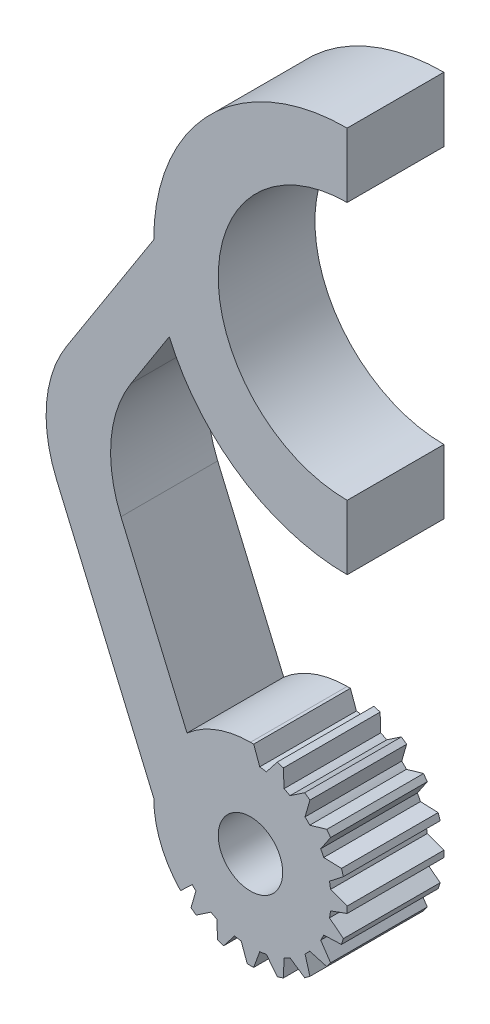
from build123d import *

# Parameters (mm, degrees)
BOSS_EXTRUDE1_DEPTH = 15
FILLET1_R           = 20
CUT_EXTRUDE1_START  = -15
CUT_EXTRUDE1_DEPTH  = 15
BOSS_EXTRUDE2_START = -15
BOSS_EXTRUDE2_DEPTH = 15


with BuildPart() as part:
    # Sketch1 → Boss-Extrude1 (new body)
    # profile 1 of 6: a face of its own
    with BuildSketch(Plane.XY):
        with BuildLine():
            Line((-20, -30), (-30, -30))
            ThreePointArc((-30, -30), (-29.388396861, -36.026784376), (-27.578524672, -41.807835403))
            Line((-27.578524672, -41.807835403), (-20, -30))
        make_face()
    # profile 2 of 6: a face of its own
    with BuildSketch(Plane.XY):
        with BuildLine():
            Line((0, -10), (0, 0))
            ThreePointArc((0, 0), (-21.213203436, -8.786796564), (-30, -30))
            Line((-30, -30), (-20, -30))
            ThreePointArc((-20, -30), (-14.142135624, -15.857864376), (0, -10))
        make_face()
    # profile 3 of 6: a face of its own
    with BuildSketch(Plane.XY):
        with BuildLine():
            Line((0, -60), (0, -50))
            ThreePointArc((0, -50), (-14.142135624, -44.142135624), (-20, -30))
            Line((-20, -30), (-27.578524672, -41.807835403))
            ThreePointArc((-27.578524672, -41.807835403), (-16.519154608, -55.04231481), (0, -60))
        make_face()
    # profile 4 of 6: a face of its own
    with BuildSketch(Plane.XY):
        with BuildLine():
            ThreePointArc((-27.578524672, -41.807835403), (-29.388396861, -36.026784376), (-30, -30))
            Line((-30, -30), (-49.254650189, -60))
            Line((-49.254650189, -60), (-30, -105))
            ThreePointArc((-30, -105), (-28.650020621, -98.780921528), (-24.84307506, -93.681260081))
            Line((-24.84307506, -93.681260081), (-39.254650189, -60))
            Line((-39.254650189, -60), (-27.578524672, -41.807835403))
        make_face()
    # profile 5 of 6: a face of its own
    with BuildSketch(Plane.XY):
        with BuildLine():
            ThreePointArc((-24.84307506, -93.681260081), (-28.650020621, -98.780921528), (-30, -105))
            Line((-30, -105), (-20, -105))
            Line((-20, -105), (-24.84307506, -93.681260081))
        make_face()
    # profile 6 of 6: a face of its own
    with BuildSketch(Plane.XY):
        with BuildLine():
            Line((-20, -105), (-30, -105))
            ThreePointArc((-30, -105), (-15, -120), (0, -105))
            ThreePointArc((0, -105), (-8.780921528, -91.349979379), (-24.84307506, -93.681260081))
            Line((-24.84307506, -93.681260081), (-20, -105))
        make_face()
        with BuildLine():
            ThreePointArc((-10, -105), (-15, -110), (-20, -105))
            ThreePointArc((-20, -105), (-15, -100), (-10, -105))
        make_face(mode=Mode.SUBTRACT)
    extrude(amount=BOSS_EXTRUDE1_DEPTH)

    # Fillet1
    fillet1_edges = [part.edges().sort_by_distance(p)[0] for p in [
        (-39.254650189, -60, 7.5),
        (-49.254650189, -60, 7.5),
    ]]
    fillet(fillet1_edges, radius=FILLET1_R)

    # Sketch2 → Cut-Extrude1 (cut)
    with BuildSketch(Plane.XY.offset(15).offset(CUT_EXTRUDE1_START)):
        with BuildLine():
            Line((-15, -90), (-15, -92.5))
            ThreePointArc((-15, -92.5), (-3.506810704, -109.914936399), (-24.038127106, -113.634944031))
            Line((-24.038127106, -113.634944031), (-25.845752528, -115.361932837))
            ThreePointArc((-25.845752528, -115.361932837), (-1.208172845, -110.897923679), (-15, -90))
        make_face()
    extrude(amount=CUT_EXTRUDE1_DEPTH, mode=Mode.SUBTRACT)

    # Sketch3 → Boss-Extrude2 (add)
    with BuildSketch(Plane.XY.offset(15).offset(BOSS_EXTRUDE2_START)):
        with BuildLine():
            Line((-14.5, -90), (-15, -90))
            Line((-15, -90), (-15, -92.5))
            ThreePointArc((-15, -92.5), (-14.279138, -92.520802992), (-13.560675373, -92.583142724))
            Line((-13.560675373, -92.583142724), (-14.5, -90))
        make_face()
        with BuildLine():
            Line((-10.840273343, -90.579643758), (-12.53185915, -92.746091205))
            ThreePointArc((-12.53185915, -92.746091205), (-11.13728757, -93.111793546), (-9.79410102, -93.635642746))
            Line((-9.79410102, -93.635642746), (-9.889216826, -90.888660753))
            Line((-9.889216826, -90.888660753), (-10.840273343, -90.579643758))
        make_face()
        with BuildLine():
            Line((-6.587729713, -92.570852458), (-8.865992497, -94.108537658))
            ThreePointArc((-8.865992497, -94.108537658), (-7.652684346, -94.88728757), (-6.53711633, -95.800565236))
            Line((-6.53711633, -95.800565236), (-5.778712718, -93.158637711))
            Line((-5.778712718, -93.158637711), (-6.587729713, -92.570852458))
        make_face()
        with BuildLine():
            Line((-3.158637711, -95.778712718), (-5.800565236, -96.53711633))
            ThreePointArc((-5.800565236, -96.53711633), (-4.88728757, -97.652684346), (-4.108537658, -98.865992497))
            Line((-4.108537658, -98.865992497), (-2.570852458, -96.587729713))
            Line((-2.570852458, -96.587729713), (-3.158637711, -95.778712718))
        make_face()
        with BuildLine():
            Line((-0.888660753, -99.889216826), (-3.635642746, -99.79410102))
            ThreePointArc((-3.635642746, -99.79410102), (-3.111793546, -101.13728757), (-2.746091205, -102.53185915))
            Line((-2.746091205, -102.53185915), (-0.579643758, -100.840273343))
            Line((-0.579643758, -100.840273343), (-0.888660753, -99.889216826))
        make_face()
        with BuildLine():
            Line((0, -104.5), (-2.583142724, -103.560675373))
            ThreePointArc((-2.583142724, -103.560675373), (-2.5, -105), (-2.583142724, -106.439324627))
            Line((-2.583142724, -106.439324627), (0, -105.5))
            Line((0, -105.5), (0, -104.5))
        make_face()
        with BuildLine():
            Line((-0.579643758, -109.159726657), (-2.746091205, -107.46814085))
            ThreePointArc((-2.746091205, -107.46814085), (-3.111793546, -108.86271243), (-3.635642746, -110.20589898))
            Line((-3.635642746, -110.20589898), (-0.888660753, -110.110783174))
            Line((-0.888660753, -110.110783174), (-0.579643758, -109.159726657))
        make_face()
        with BuildLine():
            ThreePointArc((-21.134007503, -115.891462342), (-22.347315654, -115.11271243), (-23.46288367, -114.199434764))
            Line((-23.46288367, -114.199434764), (-24.221287282, -116.841362289))
            Line((-24.221287282, -116.841362289), (-23.412270287, -117.429147542))
            Line((-23.412270287, -117.429147542), (-21.134007503, -115.891462342))
        make_face()
        with BuildLine():
            Line((-2.570852458, -113.412270287), (-4.108537658, -111.134007503))
            ThreePointArc((-4.108537658, -111.134007503), (-4.88728757, -112.347315654), (-5.800565236, -113.46288367))
            Line((-5.800565236, -113.46288367), (-3.158637711, -114.221287282))
            Line((-3.158637711, -114.221287282), (-2.570852458, -113.412270287))
        make_face()
        with BuildLine():
            ThreePointArc((-17.46814085, -117.253908795), (-18.86271243, -116.888206454), (-20.20589898, -116.364357254))
            Line((-20.20589898, -116.364357254), (-20.110783174, -119.111339247))
            Line((-20.110783174, -119.111339247), (-19.159726657, -119.420356242))
            Line((-19.159726657, -119.420356242), (-17.46814085, -117.253908795))
        make_face()
        with BuildLine():
            Line((-5.778712718, -116.841362289), (-6.53711633, -114.199434764))
            ThreePointArc((-6.53711633, -114.199434764), (-7.652684346, -115.11271243), (-8.865992497, -115.891462342))
            Line((-8.865992497, -115.891462342), (-6.587729713, -117.429147542))
            Line((-6.587729713, -117.429147542), (-5.778712718, -116.841362289))
        make_face()
        with BuildLine():
            ThreePointArc((-13.560675373, -117.416857276), (-15, -117.5), (-16.439324627, -117.416857276))
            Line((-16.439324627, -117.416857276), (-15.5, -120))
            Line((-15.5, -120), (-14.5, -120))
            Line((-14.5, -120), (-13.560675373, -117.416857276))
        make_face()
        with BuildLine():
            Line((-9.889216826, -119.111339247), (-9.79410102, -116.364357254))
            ThreePointArc((-9.79410102, -116.364357254), (-11.13728757, -116.888206454), (-12.53185915, -117.253908795))
            Line((-12.53185915, -117.253908795), (-10.840273343, -119.420356242))
            Line((-10.840273343, -119.420356242), (-9.889216826, -119.111339247))
        make_face()
    extrude(amount=BOSS_EXTRUDE2_DEPTH)


solid = part.part
